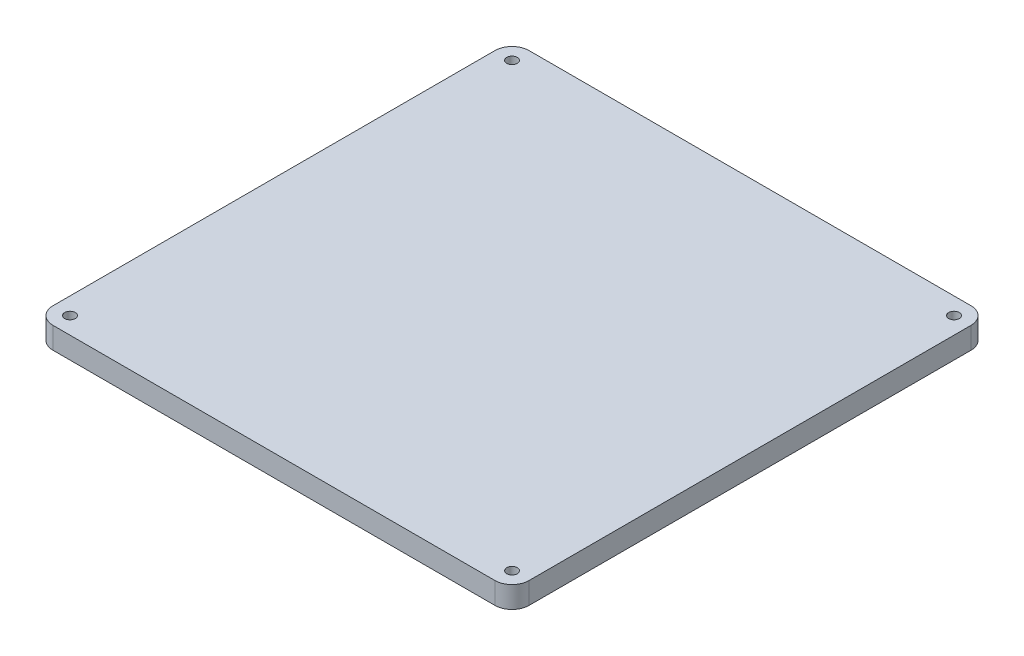
from build123d import *

# Parameters (mm, degrees)
SKETCH1_W           = 140
SKETCH1_H           = 140
BOSS_EXTRUDE1_DEPTH = 6.35
FILLET1_R           = 5
SKETCH2_R           = 1.55
CUT_EXTRUDE1_DEPTH  = 100.198399685


with BuildPart() as part:
    # Sketch1 → Boss-Extrude1 (new body)
    with BuildSketch(Plane(origin=(0, 0, 0), x_dir=(1, 0, 0), z_dir=(0, 1, 0))):
        Rectangle(SKETCH1_W, SKETCH1_H)
    extrude(amount=BOSS_EXTRUDE1_DEPTH)

    # Fillet1
    fillet1_edges = [part.edges().sort_by_distance(p)[0] for p in [
        (-70, 3.175, -70),
        (70, 3.175, -70),
        (70, 3.175, 70),
        (-70, 3.175, 70),
    ]]
    fillet(fillet1_edges, radius=FILLET1_R)

    # Sketch2 → Cut-Extrude1 (cut, through all)
    with BuildSketch(Plane(origin=(0, 6.35, 0), x_dir=(1, 0, 0), z_dir=(0, 1, 0))):
        with Locations(Location((-65, -65, 0), (0, 0, 270))):
            Circle(SKETCH2_R)
        with Locations(Location((65, -65, 0), (0, 0, 270))):
            Circle(SKETCH2_R)
        with Locations(Location((65, 65, 0), (0, 0, 270))):
            Circle(SKETCH2_R)
        with Locations(Location((-65, 65, 0), (0, 0, 270))):
            Circle(SKETCH2_R)
    extrude(amount=-CUT_EXTRUDE1_DEPTH, mode=Mode.SUBTRACT)


solid = part.part
